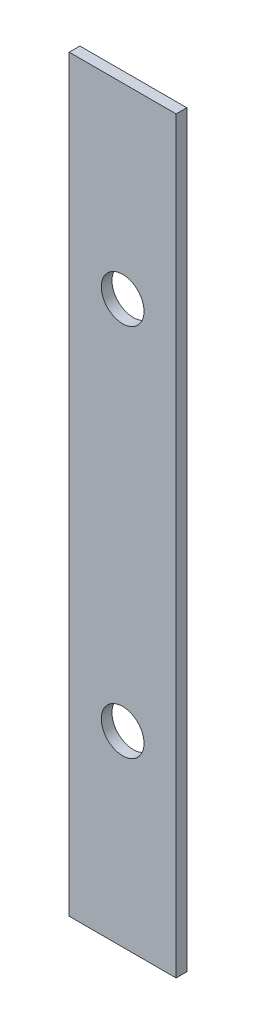
from build123d import *

# Parameters (mm, degrees)
SKETCH1_W           = 40
SKETCH1_H           = 280
BOSS_EXTRUDE1_DEPTH = 4
SKETCH3_R           = 8
BOSS_EXTRUDE2_DEPTH = 4
SKETCH3_2_R         = 8
CUT_EXTRUDE1_DEPTH  = 4


with BuildPart() as part:
    # Sketch1 → Boss-Extrude1 (new body)
    with BuildSketch(Plane.XY):
        Rectangle(SKETCH1_W, SKETCH1_H)
    extrude(amount=BOSS_EXTRUDE1_DEPTH)

    # Sketch3 → Boss-Extrude2 (add)
    with BuildSketch(Plane(origin=(0, 0, 0), x_dir=(-1, 0, 0), z_dir=(0, 0, -1))):
        with Locations((0, 70)):
            Circle(SKETCH3_R)
        with Locations((0, -70)):
            Circle(SKETCH3_R)
    extrude(amount=-BOSS_EXTRUDE2_DEPTH)

    # Sketch3<2> → Cut-Extrude1 (cut)
    with BuildSketch(Plane(origin=(0, 0, 0), x_dir=(-1, 0, 0), z_dir=(0, 0, -1))):
        with Locations((0, 70)):
            Circle(SKETCH3_2_R)
        with Locations((0, -70)):
            Circle(SKETCH3_2_R)
    extrude(amount=-CUT_EXTRUDE1_DEPTH, mode=Mode.SUBTRACT)


solid = part.part
